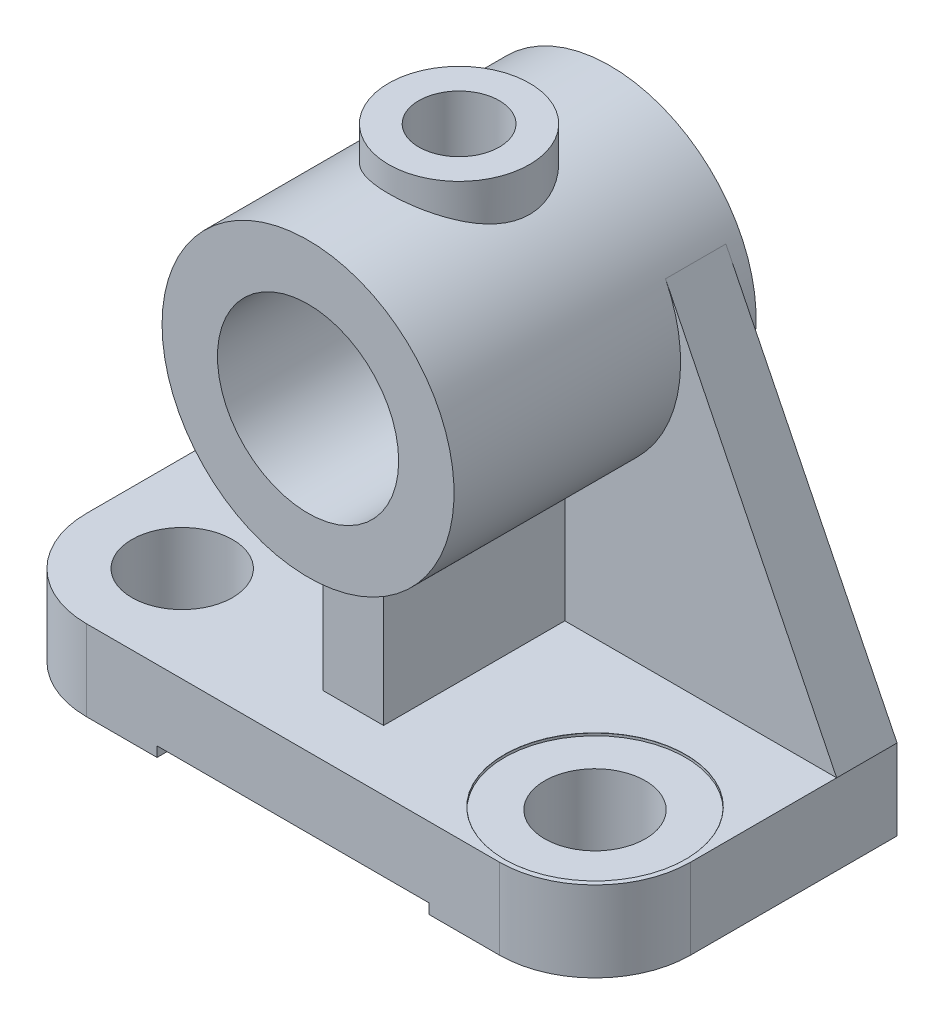
from build123d import *

# Parameters (mm, degrees)
SKETCH_3_W               = 120
SKETCH_3_H               = 60
EXTRUDE_2_DEPTH          = 16
FILLET_3_R               = 19
SKETCH_4_R               = 29
EXTRUDE_3_DEPTH          = 60
CUT_EXTRUDE_1_DEPTH      = 168.931533668
CUT_EXTRUDE_1_DEPTH_BACK = 168.931533668
SKETCH_5_R               = 18
EXTRUDE_4_REACH          = 172.985
EXTRUDE_4_END_RADIUS     = 29
SKETCH_9_R               = 14
CUT_EXTRUDE_2_REACH      = 172.985
CUT_EXTRUDE_2_END_RADIUS = 18
SKETCH_10_R              = 8
EXTRUDE_8_DEPTH          = 12
RIB_26_REACH             = 137.779
SKETCH_14_WALL_W         = 300.558465316
SKETCH_14_WALL_H         = 12
CUT_EXTRUDE_3_DEPTH      = 173.06103578


with BuildPart() as part:
    # 草图3 → 凸台-拉伸2 (new body)
    with BuildSketch(Plane(origin=(0, 0, 0), x_dir=(1, 0, 0), z_dir=(0, 1, 0))):
        with Locations((60, -30)):
            Rectangle(SKETCH_3_W, SKETCH_3_H)
    extrude(amount=EXTRUDE_2_DEPTH)

    # 圆角3
    fillet_3_edges = [part.edges().sort_by_distance(p)[0] for p in [
        (120, 8, 60),
        (0, 8, 60),
    ]]
    fillet(fillet_3_edges, radius=FILLET_3_R)



with BuildPart() as body_2:
    # 草图4 → 凸台-拉伸3 (new body)
    with BuildSketch(Plane(origin=(0, 0, -3), x_dir=(-1, 0, 0), z_dir=(0, 0, -1))):
        with Locations((-60, 72)):
            Circle(SKETCH_4_R)
    extrude(amount=-EXTRUDE_3_DEPTH)

    # 草图5 → 切除-拉伸1 (cut, two sides: drawn at the far end of the back side and taken through both)
    with BuildSketch(Plane.XY.offset(57).offset(-CUT_EXTRUDE_1_DEPTH_BACK)):
        with Locations((60, 72)):
            Circle(SKETCH_5_R)
    extrude(amount=CUT_EXTRUDE_1_DEPTH + CUT_EXTRUDE_1_DEPTH_BACK, mode=Mode.SUBTRACT)

    # 凸台-拉伸4: up to this cylinder (the profile starts outside it)
    extrude_4_end = Plane(origin=(60, 72, 27), z_dir=(0, 0, -1)) * Cylinder(EXTRUDE_4_END_RADIUS, 404.97, mode=Mode.PRIVATE)
    # 草图9 → 凸台-拉伸4 (add, up to the surface)
    with BuildSketch(Plane(origin=(0, 106, 0), x_dir=(1, 0, 0), z_dir=(0, 1, 0)), mode=Mode.PRIVATE) as extrude_4_sk1:
        with Locations(Location((60, -27, 0), (0, 0, 270))):
            Circle(SKETCH_9_R)
    extrude_4_tool1 = extrude(extrude_4_sk1.sketch, amount=-EXTRUDE_4_REACH, mode=Mode.PRIVATE) - extrude_4_end
    add(extrude_4_tool1.solids().sort_by_distance((60, 106, 27))[0])

    # 切除-拉伸2: up to this cylinder (the profile starts outside it)
    cut_extrude_2_end = Plane(origin=(60, 72, 27), z_dir=(0, 0, 1)) * Cylinder(CUT_EXTRUDE_2_END_RADIUS, 382.97, mode=Mode.PRIVATE)
    # 草图10 → 切除-拉伸2 (cut, up to the surface)
    with BuildSketch(Plane(origin=(0, 106, 0), x_dir=(1, 0, 0), z_dir=(0, 1, 0)), mode=Mode.PRIVATE) as cut_extrude_2_sk1:
        with Locations(Location((60, -27, 0), (0, 0, 270))):
            Circle(SKETCH_10_R)
    cut_extrude_2_tool1 = extrude(cut_extrude_2_sk1.sketch, amount=-CUT_EXTRUDE_2_REACH, mode=Mode.PRIVATE) - cut_extrude_2_end
    add(cut_extrude_2_tool1.solids().sort_by_distance((60, 106, 27))[0], mode=Mode.SUBTRACT)


with BuildPart() as part_1:
    add(part.part)

    add(body_2.part)  # 凸台-拉伸8 merges body 2
    # 草图11 → 凸台-拉伸8 (add)
    with BuildSketch(Plane.XY):
        with BuildLine():
            ThreePointArc((33.99807912, 84.841343799), (60, 43), (86.00192088, 84.841343799))
            Line((86.00192088, 84.841343799), (120, 16))
            Line((120, 16), (0, 16))
            Line((0, 16), (33.99807912, 84.841343799))
        make_face()
    extrude(amount=EXTRUDE_8_DEPTH)

    # 草图14 wall → 筋26 (add, up to next)
    with BuildSketch(Plane(origin=(60, 29.5, 48), x_dir=(0, 1, 0), z_dir=(0, 0, 1)), mode=Mode.PRIVATE) as rib_26_sk1:
        Rectangle(SKETCH_14_WALL_W, SKETCH_14_WALL_H)
    rib_26_tool1 = extrude(rib_26_sk1.sketch, amount=-RIB_26_REACH, mode=Mode.PRIVATE) - part_1.part
    add(rib_26_tool1.solids().sort_by_distance((60, 29.5, 48))[0])

    # 草图16 → 切除-拉伸3 (cut, through all)
    with BuildSketch(Plane.XY.offset(60)):
        Polygon((33, 0), (33, 2), (87, 2), (87, 0), (60, 0), align=None)
    extrude(amount=-CUT_EXTRUDE_3_DEPTH, mode=Mode.SUBTRACT)

    # 草图20 → M18 六角头螺栓C级的柱形沉头孔1 (revolve, cut)
    with BuildSketch(Plane(origin=(101, 16, 41), x_dir=(0, 0, 1), z_dir=(1, 0, 0))):
        Polygon((0, 0), (0, 16), (10, 16), (10, 0.5), (18, 0.5), (18, 0.020977491), (18.025, 0), align=None)
    revolve(axis=Axis((101, 22.35, 41), (0, -1, 0)), mode=Mode.SUBTRACT)

    # 草图22 → M18 六角头螺栓C级的柱形沉头孔2 (revolve, cut)
    with BuildSketch(Plane(origin=(19, 0, 41), x_dir=(0, 0, -1), z_dir=(1, 0, 0))):
        Polygon((0, 0), (0, 106), (10, 106), (10, 0.5), (18, 0.5), (18, 0.020977491), (18.025, 0), align=None)
    revolve(axis=Axis((19, -6.35, 41), (0, 1, 0)), mode=Mode.SUBTRACT)


solid = part_1.part
